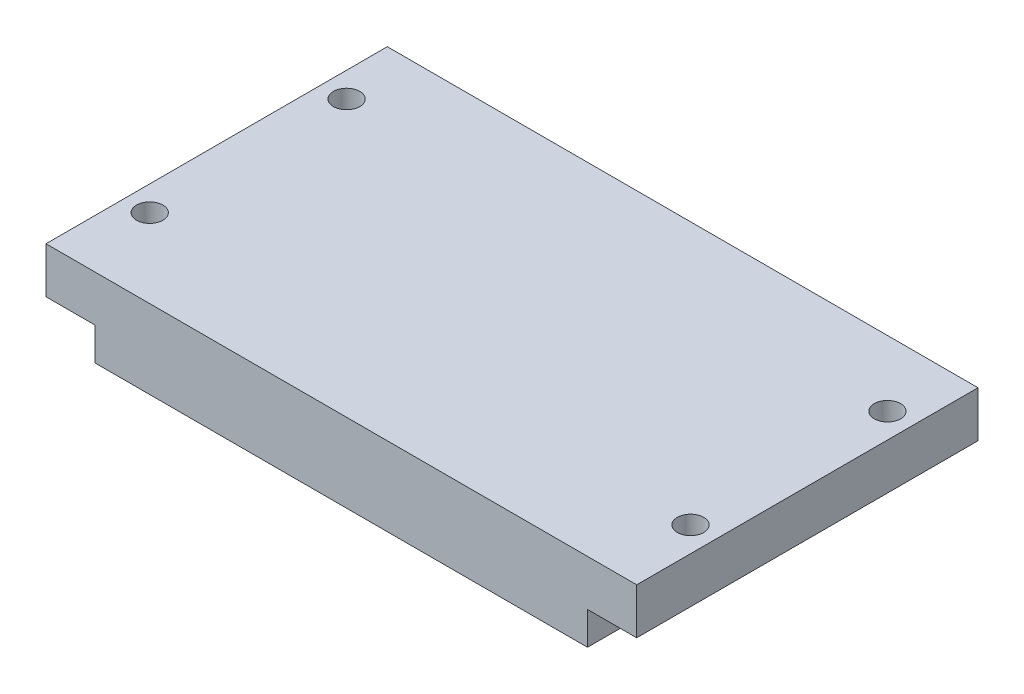
from build123d import *

# Parameters (mm, degrees)
BOSS_EXTRUDE1_DEPTH    = 66.04
F_10_CLEARANCE_HOLE1_D = 5.1054


with BuildPart() as part:
    # Sketch2 → Boss-Extrude1 (new body)
    with BuildSketch(Plane.XY):
        Polygon((0, 0), (114.3, 0), (114.3, -8.89), (104.775, -8.89), (104.775, -15.24), (9.525, -15.24), (9.525, -8.89), (0, -8.89), align=None)
    extrude(amount=BOSS_EXTRUDE1_DEPTH)

    # #10 Clearance Hole1 (through all)
    with Locations(Plane(origin=(4.826, 0, 12.7), x_dir=(0, 0, 1), z_dir=(0, 1, 0))):
        with Locations((0, 0), (38.1, 0), (38.1, 104.648), (0, 104.648)):
            Hole(F_10_CLEARANCE_HOLE1_D / 2)


solid = part.part
